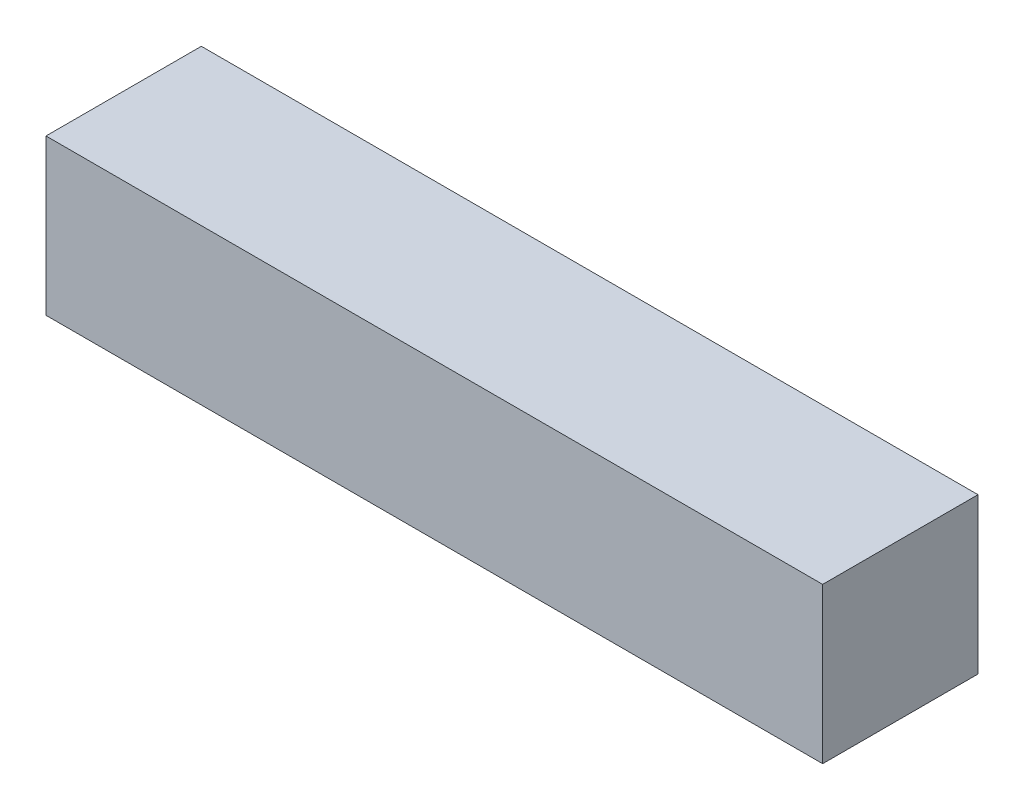
from build123d import *

# Parameters (mm, degrees)
SKETCH1_W           = 110
SKETCH1_H           = 22
BOSS_EXTRUDE1_DEPTH = 22


with BuildPart() as part:
    # Sketch1 → Boss-Extrude1 (new body)
    with BuildSketch(Plane.XY):
        with Locations((55, 11)):
            Rectangle(SKETCH1_W, SKETCH1_H)
    extrude(amount=BOSS_EXTRUDE1_DEPTH)


solid = part.part
